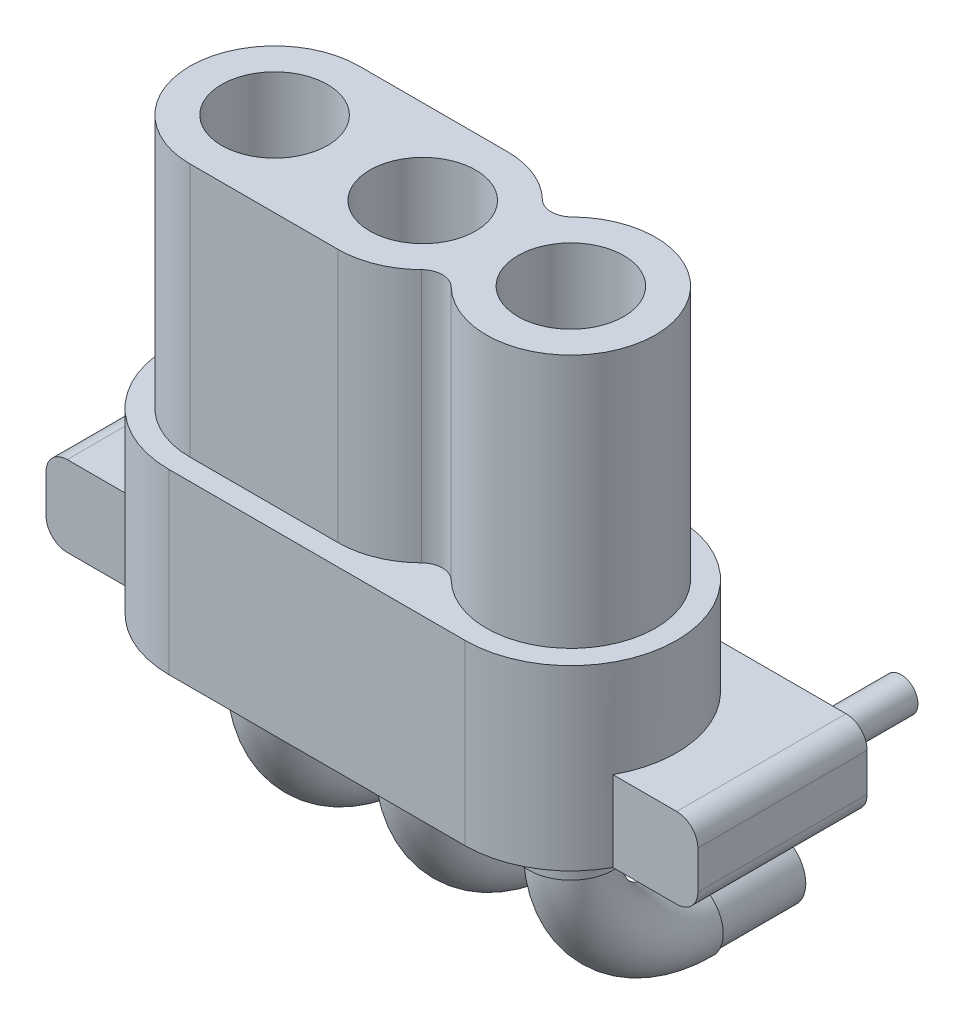
from build123d import *

# Parameters (mm, degrees)
SKETCH_1_R             = 0.75
EXTRUDE_1_DEPTH        = 2
SKETCH_2_R             = 0.8
SKETCH_4_R             = 1
EXTRUDE_2_DEPTH        = 1.25
EXTRUDE_3_DEPTH        = 4.2
SKETCH_6_R             = 0.4
EXTRUDE_4_DEPTH        = 2
EXTRUDE_4_2_DEPTH      = 2
SKETCH_7_W             = 4.2
SKETCH_7_H             = 1.9
EXTRUDE_5_DEPTH        = 4
EXTRUDE_6_DEPTH        = 6
SKETCH_9_R             = 1.25
CUT_EXTRUDE_1_DEPTH    = 6
PATTERN_LINEAR_2_COUNT = 3
PATTERN_LINEAR_2_PITCH = 3.5
CUT_EXTRUDE_START      = -6
CUT_EXTRUDE_2_DEPTH    = 6
FILLET_1_R             = 0.5
FILLET_2_R             = 0.5


with BuildPart() as part:
    # ｽｹｯﾁ1 → ﾎﾞｽ - 押し出し1 (new body)
    with BuildSketch(Plane.XY):
        Circle(SKETCH_1_R)
    extrude_1 = extrude(amount=-EXTRUDE_1_DEPTH)

    # ｽｲｰﾌﾟ1: sweep along a path in ｽｹｯﾁ3
    with BuildLine(Plane(origin=(0, 0, 0), x_dir=(0, 0, -1), z_dir=(1, 0, 0))) as sweep_1_path:
        ThreePointArc((0, 0), (-1.979898987, 0.820101013), (-2.8, 2.8))
    # ｽｹｯﾁ2 → ｽｲｰﾌﾟ1 (sweep)
    with BuildSketch(Plane.XY):
        Circle(SKETCH_2_R)
    sweep_1 = sweep(path=sweep_1_path.line)

    # ｽｹｯﾁ4 → ﾎﾞｽ - 押し出し2 (add)
    with BuildSketch(Plane(origin=(0, 2.8, 0), x_dir=(1, 0, 0), z_dir=(0, 1, 0))):
        with Locations(Location((0, -2.8, 0), (0, 0, 270))):
            Circle(SKETCH_4_R)
    extrude_2 = extrude(amount=EXTRUDE_2_DEPTH)

    # ｽｹｯﾁ5 → ﾎﾞｽ - 押し出し3 (add)
    with BuildSketch(Plane(origin=(0, 4.05, 0), x_dir=(1, 0, 0), z_dir=(0, 1, 0))):
        with BuildLine():
            Line((0, -0.3), (-7, -0.3))
            ThreePointArc((-7, -0.3), (-9.5, -2.8), (-7, -5.3))
            Line((-7, -5.3), (0, -5.3))
            ThreePointArc((0, -5.3), (2.5, -2.8), (0, -0.3))
        make_face()
    extrude(amount=EXTRUDE_3_DEPTH)



with BuildPart() as body_2:
    # ｽｹｯﾁ6 → ﾎﾞｽ - 押し出し4 (new body)
    with BuildSketch(Plane.XY):
        with Locations((3, 5)):
            Circle(SKETCH_6_R)
    extrude(amount=-EXTRUDE_4_DEPTH)


with BuildPart() as body_3:
    # ｽｹｯﾁ6 → Extrude 4 2 (new body)
    with BuildSketch(Plane.XY):
        with Locations((-10, 5)):
            Circle(SKETCH_6_R)
    extrude(amount=-EXTRUDE_4_2_DEPTH)


with BuildPart() as part_1:
    add(part.part)

    add(body_2.part)  # ﾎﾞｽ - 押し出し5 merges body 2
    # ｽｹｯﾁ7 → ﾎﾞｽ - 押し出し5 (add)
    with BuildSketch(Plane.XY):
        with Locations((2.1, 5)):
            Rectangle(SKETCH_7_W, SKETCH_7_H)
        with Locations((-9.1, 5)):
            Rectangle(SKETCH_7_W, SKETCH_7_H)
    extrude(amount=EXTRUDE_5_DEPTH)

    # ｽｹｯﾁ8 → ﾎﾞｽ - 押し出し6 (add)
    with BuildSketch(Plane(origin=(0, 8.25, 0), x_dir=(1, 0, 0), z_dir=(0, 1, 0))):
        with BuildLine():
            Line((-7, -0.8), (0, -0.8))
            ThreePointArc((0, -0.8), (2, -2.8), (0, -4.8))
            Line((0, -4.8), (-7, -4.8))
            ThreePointArc((-7, -4.8), (-9, -2.8), (-7, -0.8))
        make_face()
    extrude(amount=EXTRUDE_6_DEPTH)

    # ｽｹｯﾁ9 → ｶｯﾄ - 押し出し1 (cut)
    with BuildSketch(Plane(origin=(0, 14.25, 0), x_dir=(1, 0, 0), z_dir=(0, 1, 0))):
        with Locations(Location((0, -2.8, 0), (0, 0, 270))):
            Circle(SKETCH_9_R)
    cut_extrude_1 = extrude(amount=-CUT_EXTRUDE_1_DEPTH, mode=Mode.SUBTRACT)

    # 直線ﾊﾟﾀｰﾝ2: ﾎﾞｽ - 押し出し1, ｽｲｰﾌﾟ1, ﾎﾞｽ - 押し出し2, ｶｯﾄ - 押し出し1 ×3
    with Locations(*[(-i * PATTERN_LINEAR_2_PITCH, 0, 0) for i in range(1, PATTERN_LINEAR_2_COUNT)]):
        add(extrude_1)
        add(sweep_1)
        add(extrude_2)
        add(cut_extrude_1, mode=Mode.SUBTRACT)

    # ｽｹｯﾁ10 → ｶｯﾄ - 押し出し2 (cut)
    with BuildSketch(Plane(origin=(0, 14.25, 0), x_dir=(1, 0, 0), z_dir=(0, 1, 0)).offset(CUT_EXTRUDE_START)):
        with BuildLine():
            Line((-3.5, -0.8), (0, -0.8))
            ThreePointArc((0, -0.8), (-1.015753003, -1.077140216), (-1.75, -1.831754163))
            ThreePointArc((-1.75, -1.831754163), (-2.484246997, -1.077140216), (-3.5, -0.8))
        make_face()
    cut_extrude_2 = extrude(amount=CUT_EXTRUDE_2_DEPTH, mode=Mode.SUBTRACT)

    # ﾐﾗｰ18: ｶｯﾄ - 押し出し2 across plane
    add(cut_extrude_2.mirror(Plane(origin=(0, 0, 2.8), x_dir=(1, 0, 0), z_dir=(0, 0, -1))), mode=Mode.SUBTRACT)

    # ﾌｨﾚｯﾄ1
    fillet_1_edges = [part_1.edges().sort_by_distance(p)[0] for p in [
        (4.2, 4.05, 2),
        (4.2, 5.95, 2),
        (-11.2, 5.95, 2),
        (-11.2, 4.05, 2),
    ]]
    fillet(fillet_1_edges, radius=FILLET_1_R)

    # ﾌｨﾚｯﾄ2
    fillet_2_edges = [part_1.edges().sort_by_distance(p)[0] for p in [
        (-1.75, 11.25, 1.831754163),
        (-1.75, 11.25, 3.768245837),
    ]]
    fillet(fillet_2_edges, radius=FILLET_2_R)


solid = Compound([body_3.part, part_1.part])
